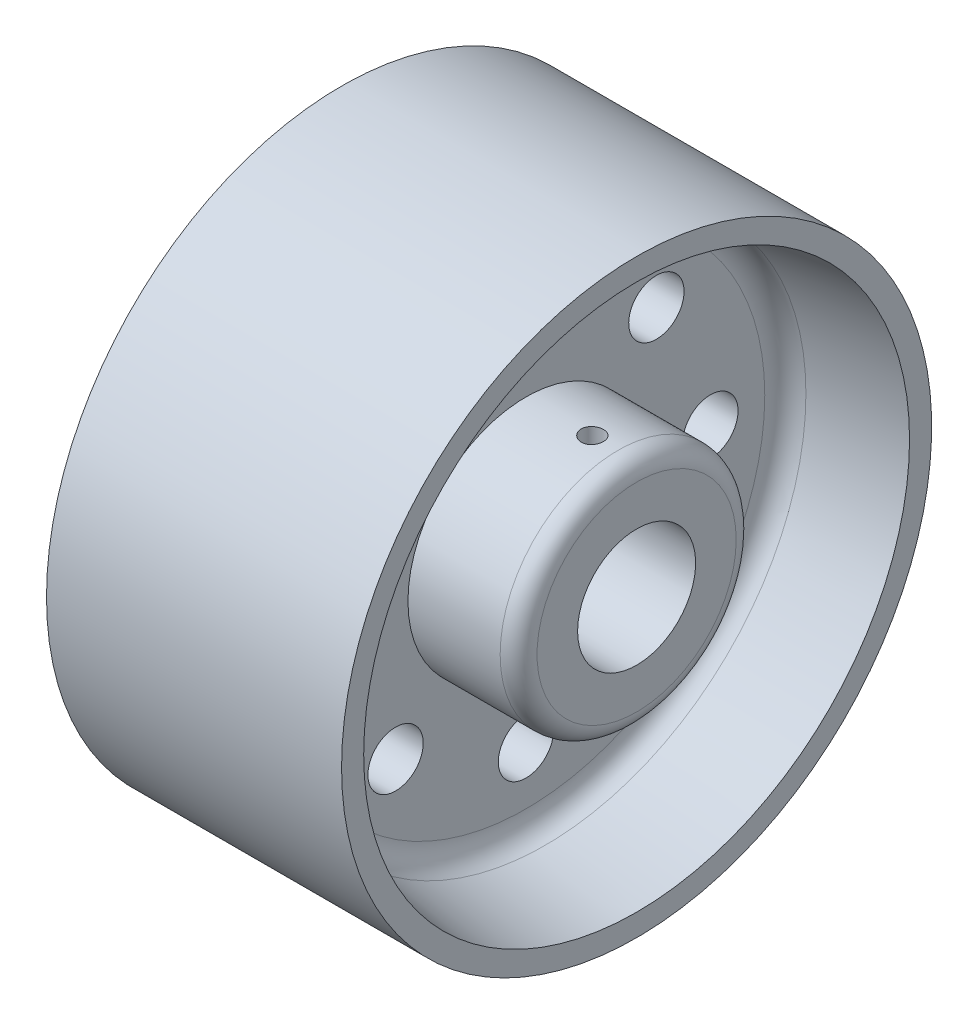
from build123d import *

# Parameters (mm, degrees)
FILLET1_R          = 3
CUT_EXTRUDE1_REACH = 62
SKETCH4_R          = 1.5
SKETCH5_R          = 3.75
CUT_EXTRUDE2_DEPTH = 62.846584425
CIRPATTERN1_COUNT  = 8
FILLET3_R          = 2.5


with BuildPart() as part:
    # Sketch2 → Base-Revolve (revolve)
    with BuildSketch(Plane.XY):
        Polygon((20, 40), (-20, 40), (-20, 37), (-5, 35), (-5, 16), (-20, 16), (-20, 8), (20, 8), (20, 16), (5, 16), (5, 35), (20, 37), align=None)
    revolve(axis=Axis((-102.775053376, 0, 0), (1, 0, 0)))

    # Fillet1
    fillet1_edges = [part.edges().sort_by_distance(p)[0] for p in [
        (-5, -35, 0),
        (5, -35, 0),
    ]]
    fillet(fillet1_edges, radius=FILLET1_R)

    # Sketch4 → Cut-Extrude1 (cut, up to next)
    with BuildSketch(Plane(origin=(0, 0, 0), x_dir=(1, 0, 0), z_dir=(0, 1, 0)), mode=Mode.PRIVATE) as cut_extrude1_sk1:
        with Locations((14, 0)):
            Circle(SKETCH4_R)
    cut_extrude1_tool1 = extrude(cut_extrude1_sk1.sketch, amount=CUT_EXTRUDE1_REACH, mode=Mode.PRIVATE) & part.part
    cut_extrude1 = cut_extrude1_tool1.solids().sort_by_distance((14, 0, 0))[0]
    add(cut_extrude1, mode=Mode.SUBTRACT)

    # Mirror1: Cut-Extrude1 across plane
    add(cut_extrude1.mirror(Plane(origin=(0, 0, 0), x_dir=(0, 0, 1), z_dir=(1, 0, 0))), mode=Mode.SUBTRACT)

    # Sketch5 → Cut-Extrude2 (cut, through all)
    with BuildSketch(Plane(origin=(5, 0, 0), x_dir=(0, 0, -1), z_dir=(1, 0, 0))):
        with Locations((-17.67766953, 17.67766953)):
            Circle(SKETCH5_R)
    cut_extrude2 = extrude(amount=-CUT_EXTRUDE2_DEPTH, mode=Mode.SUBTRACT)

    # CirPattern1: Cut-Extrude2 ×8 about axis
    cirpattern1_axis = Axis((0, 0, 0), (1, 0, 0))
    for i in range(1, CIRPATTERN1_COUNT):
        add(cut_extrude2.rotate(cirpattern1_axis, i * 360 / CIRPATTERN1_COUNT), mode=Mode.SUBTRACT)

    # Fillet3
    fillet3_edges = [part.edges().sort_by_distance(p)[0] for p in [
        (-20, -16, 0),
        (20, -16, 0),
    ]]
    fillet(fillet3_edges, radius=FILLET3_R)


solid = part.part
